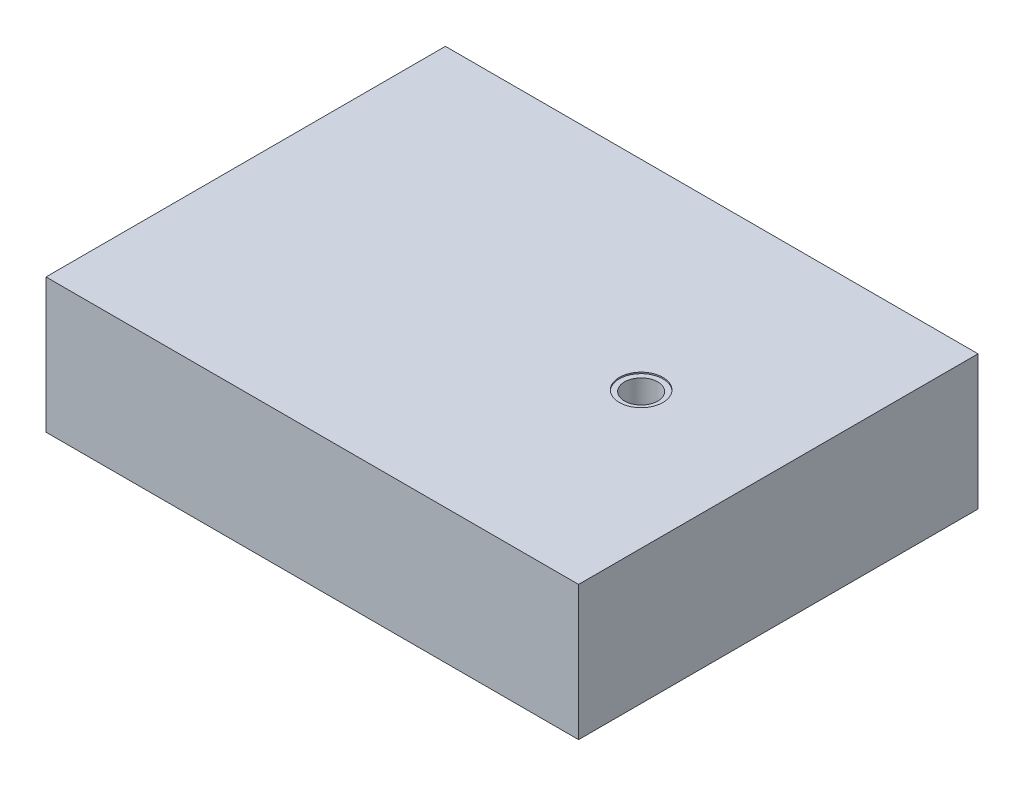
from build123d import *

# Parameters (mm, degrees)
SKETCH1_W           = 4
SKETCH1_H           = 3
BOSS_EXTRUDE1_DEPTH = 1
SKETCH2_R           = 0.125
CUT_EXTRUDE1_DEPTH  = 0.2
SKETCH3_W           = 4
SKETCH3_H           = 3
SKETCH3_R           = 0.163722277
BOSS_EXTRUDE2_DEPTH = 0.01


with BuildPart() as part:
    # Sketch1 → Boss-Extrude1 (new body)
    with BuildSketch(Plane(origin=(0, 0, 0), x_dir=(1, 0, 0), z_dir=(0, 1, 0))):
        with Locations((2, 1.5)):
            Rectangle(SKETCH1_W, SKETCH1_H)
    extrude(amount=BOSS_EXTRUDE1_DEPTH)

    # Sketch2 → Cut-Extrude1 (cut)
    with BuildSketch(Plane(origin=(0, 1, 0), x_dir=(1, 0, 0), z_dir=(0, 1, 0))):
        with Locations(Location((2.97, 1.5, 0), (0, 0, 270))):
            Circle(SKETCH2_R)
    extrude(amount=-CUT_EXTRUDE1_DEPTH, mode=Mode.SUBTRACT)

    # Sketch3 → Boss-Extrude2 (add)
    with BuildSketch(Plane(origin=(0, 1, 0), x_dir=(1, 0, 0), z_dir=(0, 1, 0))):
        with Locations((2, 1.5)):
            Rectangle(SKETCH3_W, SKETCH3_H)
        with Locations(Location((2.97, 1.5, 0), (0, 0, 270))):
            Circle(SKETCH3_R, mode=Mode.SUBTRACT)
    extrude(amount=BOSS_EXTRUDE2_DEPTH)


solid = part.part
